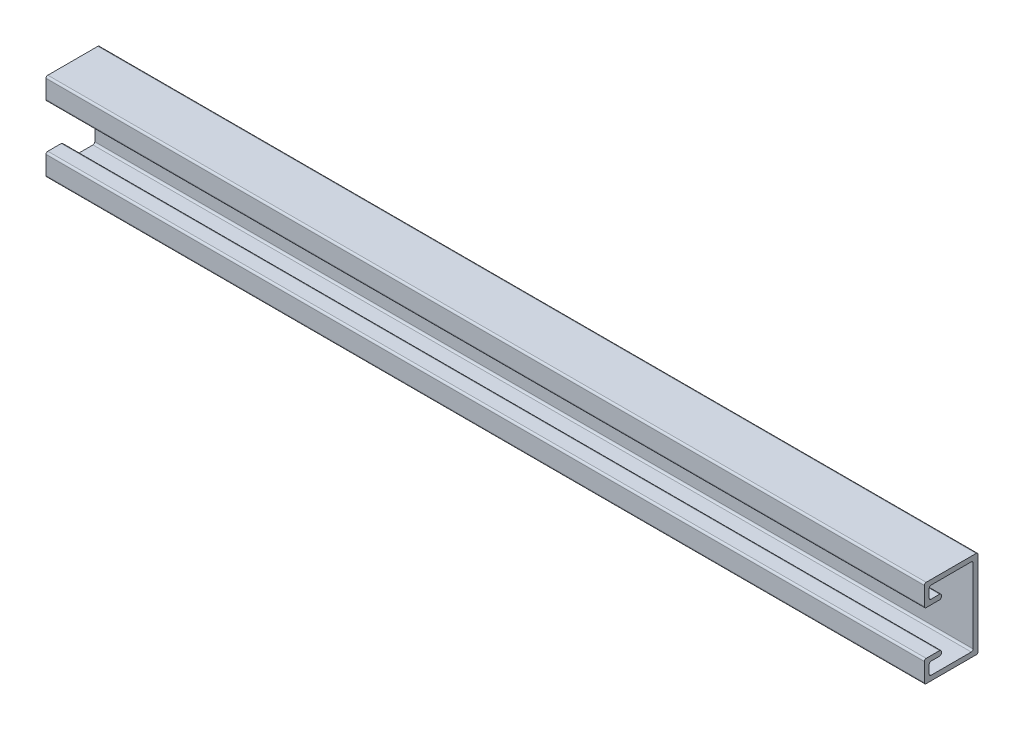
from build123d import *

# Parameters (mm, degrees)
EXTRUDE_THIN1_DEPTH = 914.4
FILLET1_R           = 1.905


with BuildPart() as part:
    # Sketch1 → Extrude-Thin1 (new body)
    with BuildSketch(Plane(origin=(0, 0, 0), x_dir=(0, 0, -1), z_dir=(1, 0, 0))):
        Polygon((-33.02, 12.7), (-45.72, 12.7), (-45.72, 0), (0, 0), (0, 81.28), (-45.72, 81.28), (-45.72, 68.58), (-33.02, 68.58), (-33.02, 63.5), (-50.8, 63.5), (-50.8, 86.36), (5.08, 86.36), (5.08, -5.08), (-50.8, -5.08), (-50.8, 17.78), (-33.02, 17.78), align=None)
    extrude(amount=EXTRUDE_THIN1_DEPTH)

    # Fillet1
    fillet1_edges = [part.edges().sort_by_distance(p)[0] for p in [
        (457.2, 12.7, 45.72),
        (457.2, 0, 45.72),
        (457.2, 0, 0),
        (457.2, 81.28, 0),
        (457.2, 81.28, 45.72),
        (457.2, 68.58, 45.72),
        (457.2, 68.58, 33.02),
        (457.2, 63.5, 33.02),
        (457.2, 63.5, 50.8),
        (457.2, 86.36, 50.8),
        (457.2, 86.36, -5.08),
        (457.2, -5.08, -5.08),
        (457.2, -5.08, 50.8),
        (457.2, 17.78, 50.8),
        (457.2, 17.78, 33.02),
        (457.2, 12.7, 33.02),
    ]]
    fillet(fillet1_edges, radius=FILLET1_R)


solid = part.part
